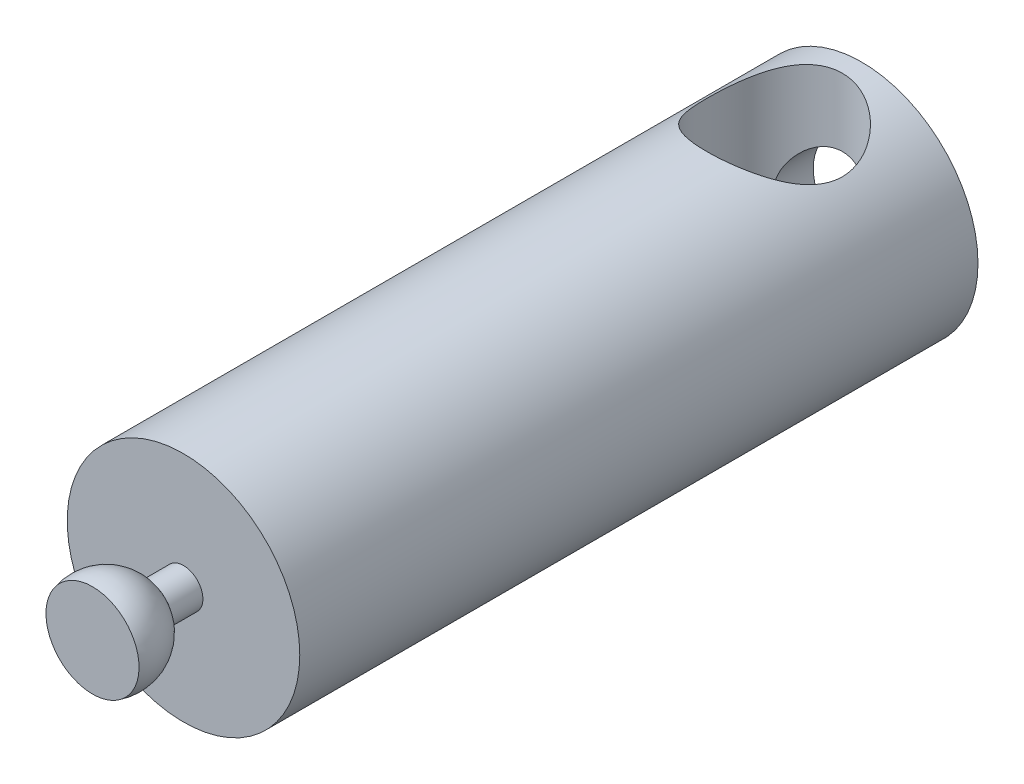
from build123d import *

# Parameters (mm, degrees)
ESQUISSE1_R             = 6
BASE_EXTRUSION_DEPTH    = 35
ESQUISSE2_R             = 3.5
ENL_V_MAT_EXTRU_1_DEPTH = 17.5
ESQUISSE3_R             = 2.5
ENL_V_MAT_EXTRU_2_DEPTH = 8
ESQUISSE4_R             = 1
BOSS_EXTRU_1_DEPTH      = 3.5


with BuildPart() as part:
    # Esquisse1 → Base-Extrusion (new body)
    with BuildSketch(Plane.XY):
        Circle(ESQUISSE1_R)
    extrude(amount=BASE_EXTRUSION_DEPTH)

    # Esquisse2 → Enlèv. mat.-Extru.1 (cut, symmetric)
    with BuildSketch(Plane(origin=(0, 0, 0), x_dir=(1, 0, 0), z_dir=(0, 1, 0))):
        with Locations(Location((0, -4.5, 0), (0, 0, 270))):
            Circle(ESQUISSE2_R)
    extrude(amount=ENL_V_MAT_EXTRU_1_DEPTH, both=True, mode=Mode.SUBTRACT)

    # Esquisse3 → Enlèv. mat.-Extru.2 (cut)
    with BuildSketch(Plane(origin=(0, 0, 0), x_dir=(-1, 0, 0), z_dir=(0, 0, -1))):
        Circle(ESQUISSE3_R)
    extrude(amount=-ENL_V_MAT_EXTRU_2_DEPTH, mode=Mode.SUBTRACT)

    # Esquisse4 → Boss.-Extru.1 (add)
    with BuildSketch(Plane(origin=(0, 0, 8), x_dir=(-1, 0, 0), z_dir=(0, 0, -1))):
        Circle(ESQUISSE4_R)
    extrude(amount=BOSS_EXTRU_1_DEPTH)

    # Esquisse5 → Boss.-Révol.1 (revolve)
    with BuildSketch(Plane(origin=(0, 0, 0), x_dir=(0, 0, -1), z_dir=(1, 0, 0))):
        with BuildLine():
            Line((-35, 1), (-36.708712153, 1))
            ThreePointArc((-36.708712153, 1), (-37.938114865, 2.263271959), (-39.69545069, 2.401322206))
            Line((-39.69545069, 2.401322206), (-39.69545069, 0))
            Line((-39.69545069, 0), (-35, 0))
            Line((-35, 0), (-35, 1))
        make_face()
    revolve(axis=Axis((0, 0, 31.912682492), (0, 0, 1)))


solid = part.part
